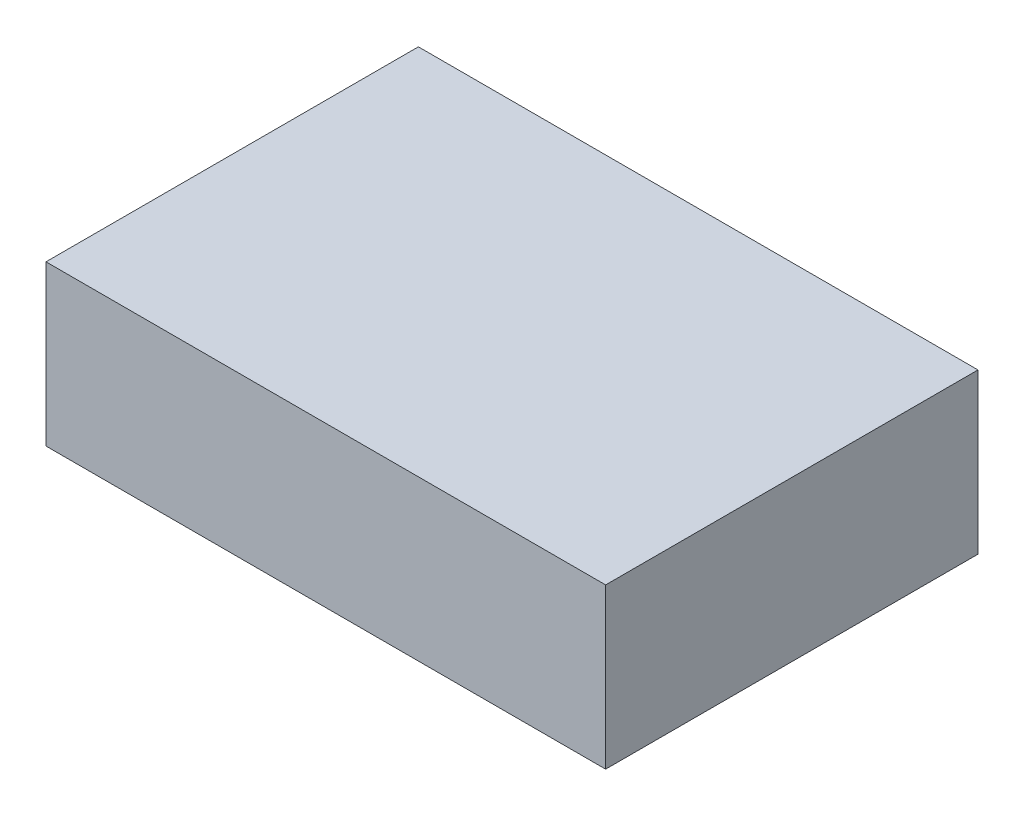
from build123d import *

# Parameters (mm, degrees)
SKETCH1_W           = 52.6
SKETCH1_H           = 35
BOSS_EXTRUDE1_DEPTH = 15


with BuildPart() as part:
    # Sketch1 → Boss-Extrude1 (new body)
    with BuildSketch(Plane(origin=(0, 0, 0), x_dir=(1, 0, 0), z_dir=(0, 1, 0))):
        Rectangle(SKETCH1_W, SKETCH1_H)
    extrude(amount=BOSS_EXTRUDE1_DEPTH)


solid = part.part
